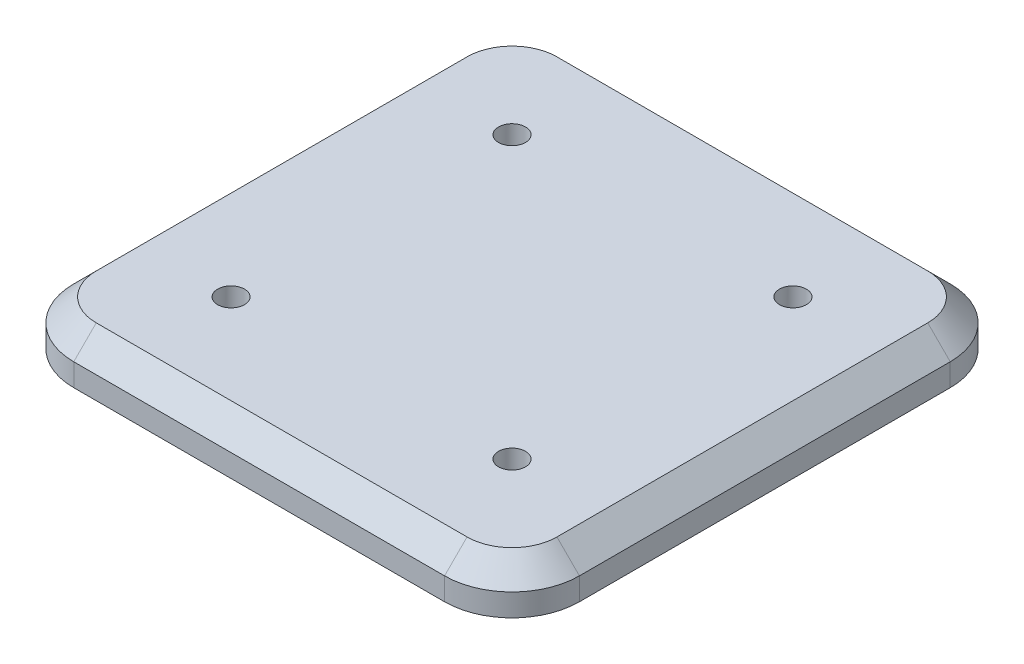
from build123d import *

# Parameters (mm, degrees)
BOSS_EXTRUDE1_DEPTH = 10
CHAMFER1_SIZE       = 10
SKETCH2_R           = 6
CUT_EXTRUDE1_DEPTH  = 10
SKETCH3_R           = 6
CUT_EXTRUDE2_DEPTH  = 10


with BuildPart() as part:
    # Sketch1 → Boss-Extrude1 (new, symmetric)
    with BuildSketch(Plane(origin=(0, 0, 0), x_dir=(1, 0, 0), z_dir=(0, 1, 0))):
        with BuildLine():
            Line((-82.5, 112.5), (82.5, 112.5))
            ThreePointArc((82.5, 112.5), (103.713203436, 103.713203436), (112.5, 82.5))
            Line((112.5, 82.5), (112.5, -82.5))
            ThreePointArc((112.5, -82.5), (103.713203436, -103.713203436), (82.5, -112.5))
            Line((82.5, -112.5), (-82.5, -112.5))
            ThreePointArc((-82.5, -112.5), (-103.713203436, -103.713203436), (-112.5, -82.5))
            Line((-112.5, -82.5), (-112.5, 82.5))
            ThreePointArc((-112.5, 82.5), (-103.713203436, 103.713203436), (-82.5, 112.5))
        make_face()
    extrude(amount=BOSS_EXTRUDE1_DEPTH, both=True)

    # Chamfer1
    chamfer1_edges = [part.edges().sort_by_distance(p)[0] for p in [
        (103.713203436, 10, 103.713203436),
        (112.5, 10, 0),
        (103.713203436, 10, -103.713203436),
        (0, 10, -112.5),
        (-103.713203436, 10, -103.713203436),
        (-112.5, 10, 0),
        (-103.713203436, 10, 103.713203436),
        (0, 10, 112.5),
    ]]
    chamfer(chamfer1_edges, length=CHAMFER1_SIZE)

    # Sketch2 → Cut-Extrude1 (cut)
    with BuildSketch(Plane(origin=(0, 10, 0), x_dir=(1, 0, 0), z_dir=(0, 1, 0))):
        with Locations(Location((62.5, 62.5, 0), (0, 0, 270))):
            Circle(SKETCH2_R)
        with Locations(Location((-62.5, 62.5, 0), (0, 0, 90))):
            Circle(SKETCH2_R)
        with Locations(Location((62.5, -62.5, 0), (0, 0, 90))):
            Circle(SKETCH2_R)
        with Locations(Location((-62.5, -62.5, 0), (0, 0, 270))):
            Circle(SKETCH2_R)
    extrude(amount=-CUT_EXTRUDE1_DEPTH, mode=Mode.SUBTRACT)

    # Sketch3 → Cut-Extrude2 (cut)
    with BuildSketch(Plane.XZ.offset(10)):
        with Locations(Location((87.5, 87.5, 0), (0, 0, 270))):
            Circle(SKETCH3_R)
        with Locations(Location((-87.5, 87.5, 0), (0, 0, 270))):
            Circle(SKETCH3_R)
        with Locations(Location((87.5, -87.5, 0), (0, 0, 270))):
            Circle(SKETCH3_R)
        with Locations(Location((-87.5, -87.5, 0), (0, 0, 270))):
            Circle(SKETCH3_R)
    extrude(amount=-CUT_EXTRUDE2_DEPTH, mode=Mode.SUBTRACT)


solid = part.part
